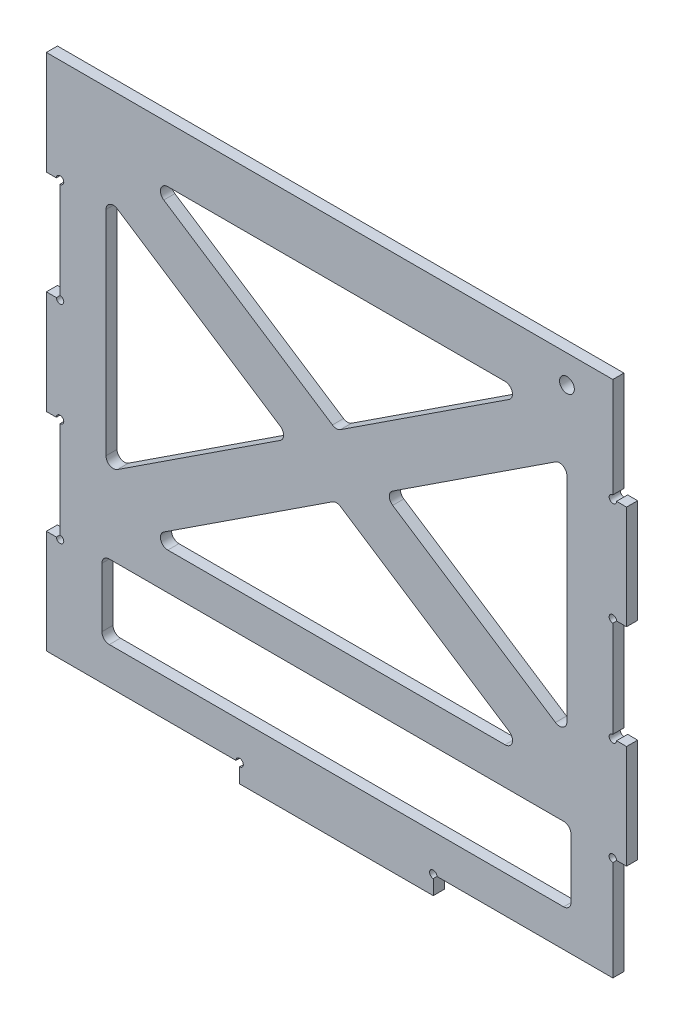
from build123d import *

# Parameters (mm, degrees)
SKETCH1_W           = 156.7
SKETCH1_H           = 140
BOSS_EXTRUDE1_DEPTH = 3
SKETCH2_W           = 126.7
SKETCH2_H           = 20
CUT_EXTRUDE1_DEPTH  = 106.108146687
FILLET1_R           = 2
SKETCH3_W           = 3.7
SKETCH3_H           = 28
CUT_EXTRUDE2_DEPTH  = 106.108146687
SKETCH4_W           = 52.3
SKETCH4_H           = 5
BOSS_EXTRUDE2_DEPTH = 3
SKETCH5_R           = 1
CUT_EXTRUDE3_DEPTH  = 109.502177398
SKETCH6_R           = 2
CUT_EXTRUDE4_DEPTH  = 109.502177398


with BuildPart() as part:
    # Sketch1 → Boss-Extrude1 (new body)
    with BuildSketch(Plane.XY):
        Rectangle(SKETCH1_W, SKETCH1_H)
    extrude(amount=BOSS_EXTRUDE1_DEPTH)

    # Sketch2 → Cut-Extrude1 (cut, through all)
    with BuildSketch(Plane.XY.offset(3)):
        with Locations((0, -50)):
            Rectangle(SKETCH2_W, SKETCH2_H)
        Polygon((-62.25, 45), (-62.25, -20), (-12.633333333, 12.5), align=None)
        Polygon((0, 4.22489083), (-52.25, -30), (52.25, -30), align=None)
        Polygon((-52.25, 55), (0, 20.77510917), (52.25, 55), align=None)
        Polygon((62.25, 45), (12.633333333, 12.5), (62.25, -20), align=None)
    extrude(amount=-CUT_EXTRUDE1_DEPTH, mode=Mode.SUBTRACT)

    # Fillet1
    fillet1_edges = [part.edges().sort_by_distance(p)[0] for p in [
        (63.35, -60, 1.5),
        (-63.35, -60, 1.5),
        (-63.35, -40, 1.5),
        (63.35, -40, 1.5),
        (-12.633333333, 12.5, 1.5),
        (-62.25, -20, 1.5),
        (-62.25, 45, 1.5),
        (-52.25, -30, 1.5),
        (0, 4.22489083, 1.5),
        (52.25, -30, 1.5),
        (52.25, 55, 1.5),
        (0, 20.77510917, 1.5),
        (-52.25, 55, 1.5),
        (12.633333333, 12.5, 1.5),
        (62.25, 45, 1.5),
        (62.25, -20, 1.5),
    ]]
    fillet(fillet1_edges, radius=FILLET1_R)

    # Sketch3 → Cut-Extrude2 (cut, through all)
    with BuildSketch(Plane.XY.offset(3)):
        with Locations((-76.5, 28)):
            Rectangle(SKETCH3_W, SKETCH3_H)
        with Locations((-76.5, -28)):
            Rectangle(SKETCH3_W, SKETCH3_H)
        with Locations((76.5, 56)):
            Rectangle(SKETCH3_W, SKETCH3_H)
        with Locations((76.5, 0)):
            Rectangle(SKETCH3_W, SKETCH3_H)
        with Locations((76.5, -56)):
            Rectangle(SKETCH3_W, SKETCH3_H)
    extrude(amount=-CUT_EXTRUDE2_DEPTH, mode=Mode.SUBTRACT)

    # Sketch4 → Boss-Extrude2 (add)
    with BuildSketch(Plane.XY.offset(3)):
        with Locations((0, -72.5)):
            Rectangle(SKETCH4_W, SKETCH4_H)
    extrude(amount=-BOSS_EXTRUDE2_DEPTH)

    # Sketch5 → Cut-Extrude3 (cut, through all)
    with BuildSketch(Plane.XY.offset(3)):
        with Locations((-74.65, 42)):
            Circle(SKETCH5_R)
        with Locations((-74.65, 14)):
            Circle(SKETCH5_R)
        with Locations((-74.65, -14)):
            Circle(SKETCH5_R)
        with Locations((-74.65, -42)):
            Circle(SKETCH5_R)
        with Locations((-26.15, -70)):
            Circle(SKETCH5_R)
        with Locations((26.15, -70)):
            Circle(SKETCH5_R)
        with Locations((74.65, -42)):
            Circle(SKETCH5_R)
        with Locations((74.65, -14)):
            Circle(SKETCH5_R)
        with Locations((74.65, 42)):
            Circle(SKETCH5_R)
        with Locations((74.65, 14)):
            Circle(SKETCH5_R)
    extrude(amount=-CUT_EXTRUDE3_DEPTH, mode=Mode.SUBTRACT)

    # Sketch6 → Cut-Extrude4 (cut, through all)
    with BuildSketch(Plane(origin=(0, 0, 0), x_dir=(-1, 0, 0), z_dir=(0, 0, -1))):
        with Locations((-62.25, 62.5)):
            Circle(SKETCH6_R)
    extrude(amount=-CUT_EXTRUDE4_DEPTH, mode=Mode.SUBTRACT)


solid = part.part
